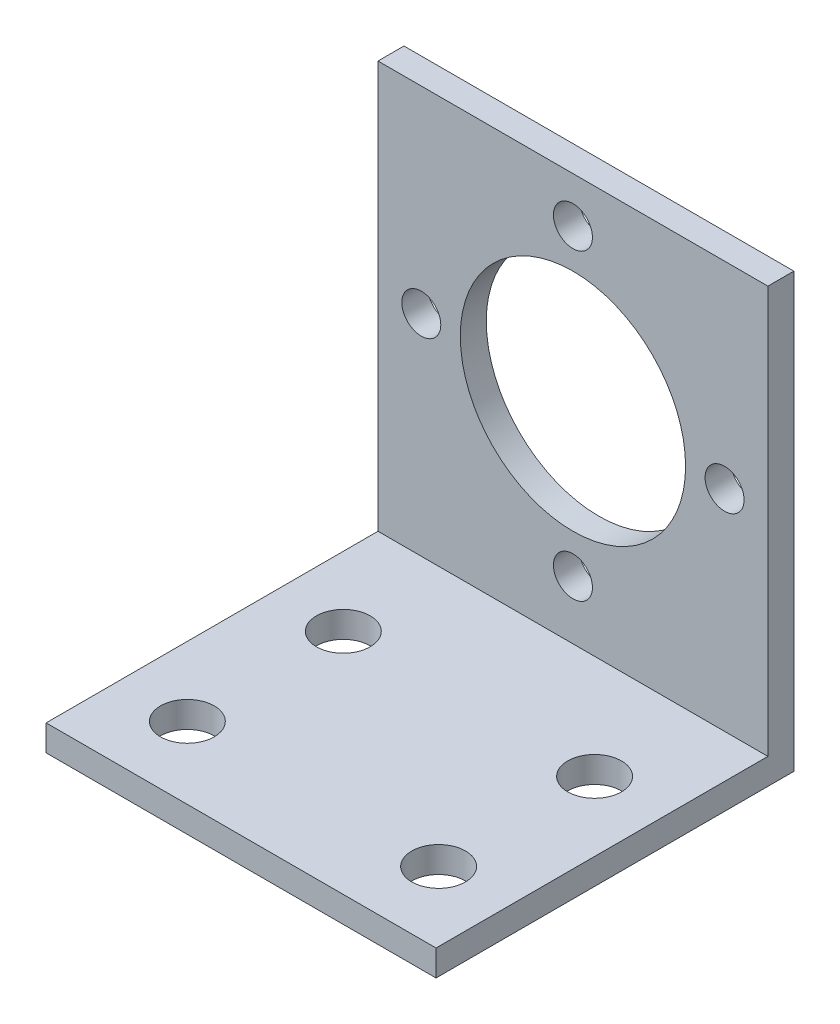
from build123d import *

# Parameters (mm, degrees)
SKETCH_1_W          = 45
SKETCH_1_H          = 50
EXTRUDE_1_DEPTH     = 3
SKETCH_2_W          = 45
SKETCH_2_H          = 3
EXTRUDE_2_DEPTH     = 41.3
SKETCH_3_R          = 13
SKETCH_3_R_2        = 2.25
CUT_EXTRUDE_1_DEPTH = 78.407299397
SKETCH_4_R          = 3.1
CUT_EXTRUDE_2_DEPTH = 78.069384323


with BuildPart() as part:
    # 草图1 → 凸台-拉伸1 (new body)
    with BuildSketch(Plane.XY):
        with Locations((22.5, 25)):
            Rectangle(SKETCH_1_W, SKETCH_1_H)
    extrude(amount=EXTRUDE_1_DEPTH)

    # 草图2 → 凸台-拉伸2 (add)
    with BuildSketch(Plane(origin=(0, 0, 0), x_dir=(-1, 0, 0), z_dir=(0, 0, -1))):
        with Locations((-22.5, 1.5)):
            Rectangle(SKETCH_2_W, SKETCH_2_H)
    extrude(amount=-EXTRUDE_2_DEPTH)

    # 草图3 → 切除-拉伸1 (cut, through all)
    with BuildSketch(Plane.XY.offset(3)):
        with Locations((22.5, 27.25)):
            Circle(SKETCH_3_R)
        with Locations((22.5, 44.75)):
            Circle(SKETCH_3_R_2)
        with Locations((40, 27.25)):
            Circle(SKETCH_3_R_2)
        with Locations((22.5, 9.75)):
            Circle(SKETCH_3_R_2)
        with Locations((5, 27.25)):
            Circle(SKETCH_3_R_2)
    extrude(amount=-CUT_EXTRUDE_1_DEPTH, mode=Mode.SUBTRACT)

    # 草图4 → 切除-拉伸2 (cut, through all)
    with BuildSketch(Plane(origin=(0, 3, 0), x_dir=(1, 0, 0), z_dir=(0, 1, 0))):
        with Locations(Location((37, -15, 0), (0, 0, 180))):
            Circle(SKETCH_4_R)
        with Locations(Location((37, -33, 0), (0, 0, 180))):
            Circle(SKETCH_4_R)
        with Locations(Location((8, -33, 0), (0, 0, 180))):
            Circle(SKETCH_4_R)
        with Locations(Location((8, -15, 0), (0, 0, 180))):
            Circle(SKETCH_4_R)
    extrude(amount=-CUT_EXTRUDE_2_DEPTH, mode=Mode.SUBTRACT)


solid = part.part
